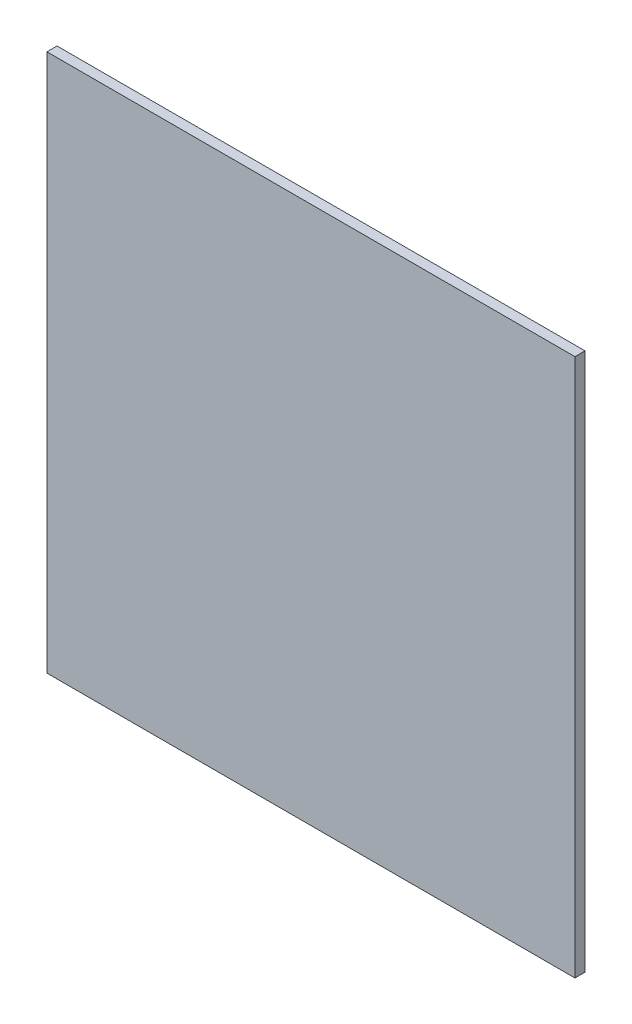
from build123d import *

# Parameters (mm, degrees)
SKETCH1_W           = 78.5
SKETCH1_H           = 80
BOSS_EXTRUDE1_DEPTH = 1.5


with BuildPart() as part:
    # Sketch1 → Boss-Extrude1 (new body)
    with BuildSketch(Plane.XY):
        with Locations((39.25, 40)):
            Rectangle(SKETCH1_W, SKETCH1_H)
    extrude(amount=BOSS_EXTRUDE1_DEPTH)


solid = part.part
